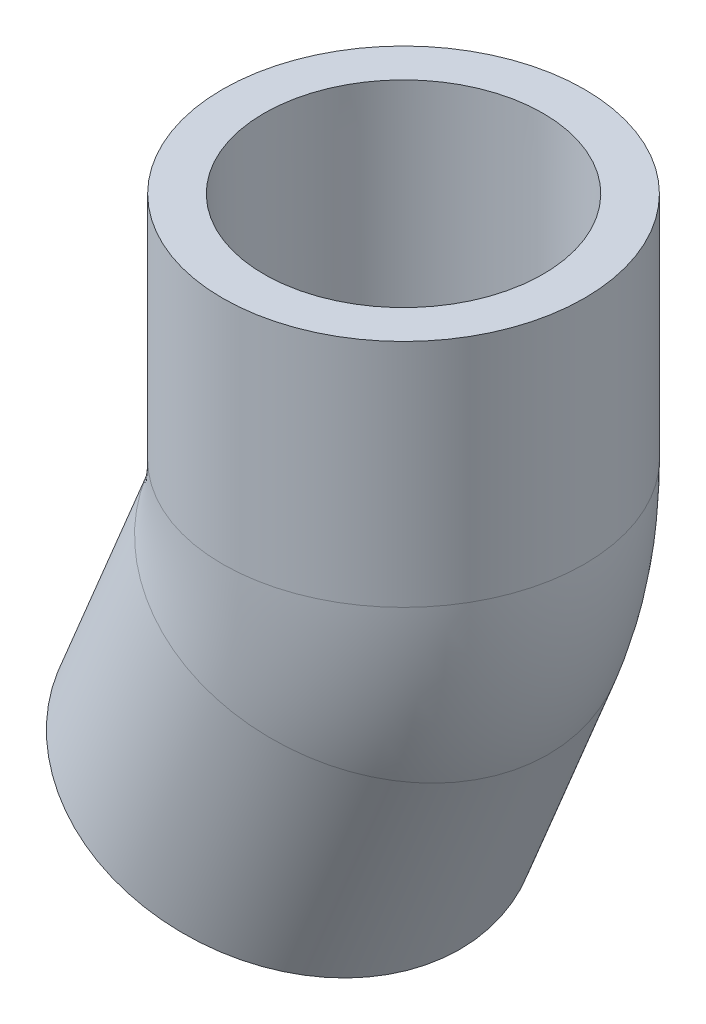
from build123d import *

# Parameters (mm, degrees)
SKETCH3_R   = 21.828125
SKETCH3_R_2 = 13.3223


with BuildPart() as part:
    # Sketch1 → Revolve1 (revolve)
    with BuildSketch(Plane.XY):
        Polygon((6.801339045, -40.61975447), (17.432763151, -14.953226207), (12.636789012, -12.966668675), (2.181363958, -38.706098131), align=None)
    revolve(axis=Axis((-13.365218875, -32.266492673, 0), (0.3826834323650906, 0.9238795325112864, 0)))



with BuildPart() as body_2:
    # Sketch2 → Revolve2 (revolve)
    with BuildSketch(Plane.XY, mode=Mode.PRIVATE) as revolve2_sk:
        Polygon((16.8275, 34.925), (16.637, 7.14375), (21.828125, 7.14375), (21.828125, 34.925), align=None)
    revolve(revolve2_sk.sketch.rotate(Axis((0, 0, 0), (0, 1, 0)), 90), axis=Axis((0, 0, 0), (0, 1, 0)))


with BuildPart() as part_1:
    add(part.part)

    add(body_2.part)  # Sweep1 merges body 2
    # Sweep1: sweep along a path in Sketch4
    with BuildLine(Plane.XY) as sweep1_path:
        ThreePointArc((-2.73379477, -6.59996441), (-0.690078525, 0.137265153), (0, 7.14375))
    # Sketch3 → Sweep1 (sweep)
    with BuildSketch(Plane(origin=(-2.73379477, -6.59996441, 0), x_dir=(0, 0, -1), z_dir=(0.38268343236509067, 0.9238795325112865, 0))):
        Circle(SKETCH3_R)
        Circle(SKETCH3_R_2, mode=Mode.SUBTRACT)
    sweep(path=sweep1_path.line)


solid = part_1.part
